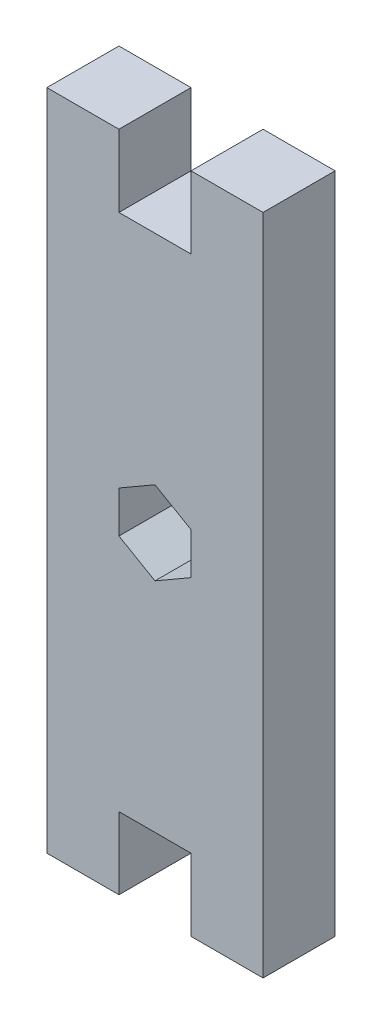
from build123d import *

# Parameters (mm, degrees)
BOSS_EXTRU_1_DEPTH = 5
CUT_EXTRUDE1_DEPTH = 10


with BuildPart() as part:
    # Esquisse1 → Boss.-Extru.1 (new body)
    with BuildSketch(Plane.XY):
        Polygon((3.468077367, 2.92543021), (8.468077367, 2.92543021), (8.468077367, -43.07456979), (3.468077367, -43.07456979), (3.468077367, -38.07456979), (-1.531922633, -38.07456979), (-1.531922633, -43.07456979), (-6.531922633, -43.07456979), (-6.531922633, 2.92543021), (-1.531922633, 2.92543021), (-1.531922633, -2.07456979), (3.468077367, -2.07456979), align=None)
    extrude(amount=BOSS_EXTRU_1_DEPTH)

    # Esquisse2 → Cut-Extrude1 (cut)
    with BuildSketch(Plane(origin=(0, 0, 0), x_dir=(-1, 0, 0), z_dir=(0, 0, -1))):
        Polygon((-3.468077367, -21.517945463), (-0.968077367, -22.961321136), (1.531922633, -21.517945463), (1.531922633, -18.631194117), (-0.968077367, -17.187818444), (-3.468077367, -18.631194117), align=None)
    extrude(amount=-CUT_EXTRUDE1_DEPTH, mode=Mode.SUBTRACT)


solid = part.part
